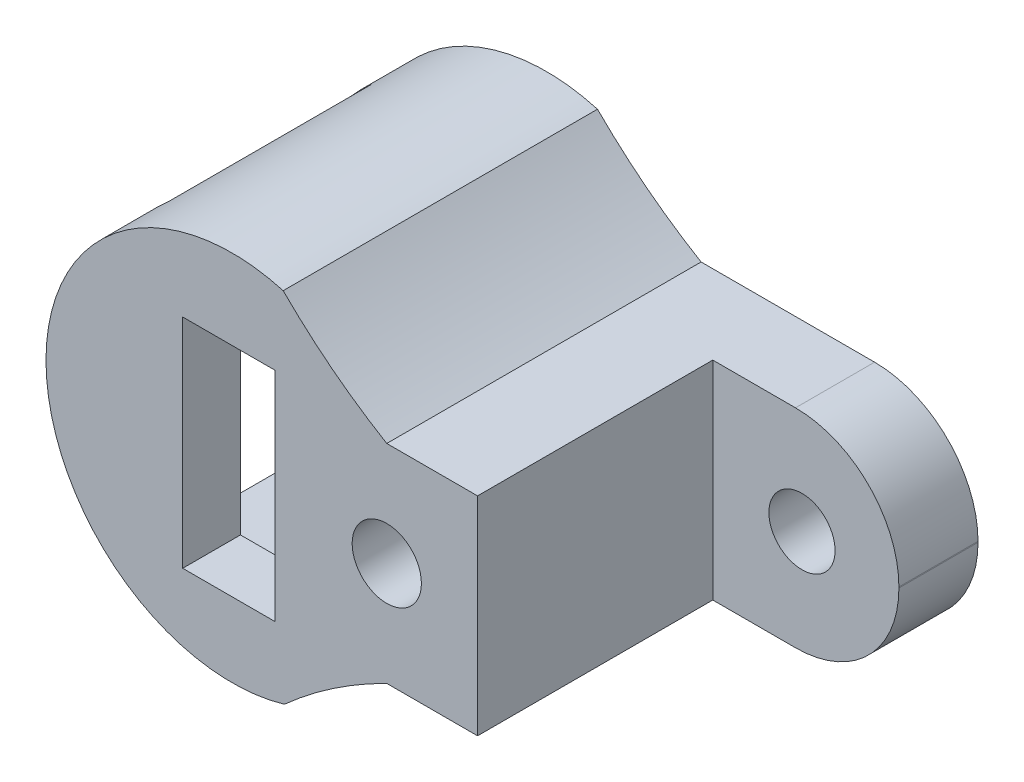
from build123d import *

# Parameters (mm, degrees)
EXTRUDE_1_DEPTH      = 2.2
EXTRUDE_2_DEPTH      = 3.25
SKETCH_3_W           = 50
SKETCH_3_H           = 10.05
EXTRUDE_3_DEPTH      = 3.25
CUT_EXTRUDE_1_DEPTH  = 30
EXTRUDE_4_REACH      = 56.389
SKETCH_6_R           = 5.025
SKETCH_8_R           = 1.675
SKETCH_8_R_2         = 0.84
CUT_EXTRUDE_3_DEPTH  = 55
SKETCH_9_W           = 28.473000816
SKETCH_9_H           = 14.532409192
CUT_EXTRUDE_4_DEPTH  = 3
EXTRUDE_5_DEPTH      = 2.45
SKETCH_11_W          = 12.614203935
SKETCH_11_H          = 10.05
EXTRUDE_6_DEPTH      = 3
SKETCH_12_W          = 36.628466797
SKETCH_12_H          = 15.348537224
CUT_EXTRUDE_5_DEPTH  = 10
SKETCH_13_W          = 5.35
SKETCH_13_H          = 5.35
CUT_EXTRUDE_6_DEPTH  = 14
SKETCH_14_R          = 1.1
CUT_EXTRUDE_7_DEPTH  = 14
SKETCH_15_R          = 1.1
CUT_EXTRUDE_8_DEPTH  = 10
SKETCH_16_R          = 1.625
EXTRUDE_7_DEPTH      = 5.7
SKETCH_17_W          = 19.923143876
SKETCH_17_H          = 15.083058075
CUT_EXTRUDE_9_DEPTH  = 3
SKETCH_18_R          = 1.675
SKETCH_18_R_2        = 1.6
CUT_EXTRUDE_10_DEPTH = 6
CUT_EXTRUDE_11_DEPTH = 10
EXTRUDE_8_DEPTH      = 9.5
EXTRUDE_9_DEPTH      = 15.2
SKETCH_23_W          = 14.793785908
SKETCH_23_H          = 11.59723546
CUT_EXTRUDE_12_DEPTH = 9
SKETCH_25_R          = 1.6
SKETCH_25_R_2        = 1.673969756
CUT_EXTRUDE_13_DEPTH = 20
FILLET_1_R           = 5
SKETCH_26_W          = 0.925753523
SKETCH_26_H          = 16.271734405
EXTRUDE_10_DEPTH     = 15
SKETCH_27_W          = 9.8
SKETCH_27_H          = 13.8
CUT_EXTRUDE_14_DEPTH = 12
SKETCH_28_W          = 4.460954542
SKETCH_28_H          = 10.524407061
CUT_EXTRUDE_15_DEPTH = 12
SKETCH_29_W          = 0.925753523
SKETCH_29_H          = 16.271734405
CUT_EXTRUDE_16_DEPTH = 18
SKETCH_30_W          = 1.5
SKETCH_30_H          = 13.8
EXTRUDE_11_DEPTH     = 3.25


with BuildPart() as part:
    # 草图1 → 凸台-拉伸1 (new body)
    with BuildSketch(Plane.XY):
        with BuildLine():
            Line((1.539836705, 12.851012384), (15.55297303, 14.251012384))
            ThreePointArc((15.55297303, 14.251012384), (17.193415997, 16.063512384), (15.55297303, 17.876012384))
            Line((15.55297303, 17.876012384), (1.500532553, 18.901012384))
            ThreePointArc((1.500532553, 18.901012384), (0.527100583, 19.384612538), (-0.54702697, 19.551012384))
            Line((-0.54702697, 19.551012384), (-0.54702697, 20.901012384))
            Line((-0.54702697, 20.901012384), (19.51277613, 20.901012384))
            Line((19.51277613, 20.901012384), (41.45297303, 20.901012384))
            Line((41.45297303, 20.901012384), (41.45297303, 10.851012384))
            Line((41.45297303, 10.851012384), (-0.54702697, 10.851012384))
            Line((-0.54702697, 10.851012384), (-0.54702697, 12.201012384))
            ThreePointArc((-0.54702697, 12.201012384), (0.54584768, 12.367273294), (1.539836705, 12.851012384))
        make_face()
    extrude(amount=EXTRUDE_1_DEPTH)

    # 草图2 → 凸台-拉伸2 (add)
    with BuildSketch(Plane(origin=(0, 0, 0), x_dir=(-1, 0, 0), z_dir=(0, 0, -1))):
        Polygon((-19.51277613, 10.851012384), (-49.45297303, 10.851012384), (-49.45297303, 20.901012384), (-19.51277613, 20.901012384), (0.54702697, 20.901012384), (0.54702697, 10.851012384), align=None)
    extrude(amount=EXTRUDE_2_DEPTH)

    # 草图3 → 凸台-拉伸3 (add)
    with BuildSketch(Plane.XY.offset(2.2)):
        with Locations((24.45297303, 15.876012384)):
            Rectangle(SKETCH_3_W, SKETCH_3_H)
    extrude(amount=EXTRUDE_3_DEPTH)

    # 草图4 → 切除-拉伸1 (cut, symmetric)
    with BuildSketch(Plane.XY):
        with BuildLine():
            Line((-0.54702697, 19.551012384), (-2.235397712, 16.616091152))
            Line((-2.235397712, 16.616091152), (-1.110896638, 12.310548833))
            Line((-1.110896638, 12.310548833), (-0.54702697, 12.201012384))
            ThreePointArc((-0.54702697, 12.201012384), (0.54584768, 12.367273294), (1.539836705, 12.851012384))
            ThreePointArc((1.539836705, 12.851012384), (2.773180655, 15.88415254), (1.500532553, 18.901012384))
            ThreePointArc((1.500532553, 18.901012384), (0.527100583, 19.384612538), (-0.54702697, 19.551012384))
        make_face()
    extrude(amount=CUT_EXTRUDE_1_DEPTH, both=True, mode=Mode.SUBTRACT)

    # 凸台-拉伸4: up to this face of the body (flat: up to its plane)
    extrude_4_end = Plane(part.part.faces().sort_by_distance((25.407741746, 15.876338503, 5.45))[0])
    # 草图6 → 凸台-拉伸4 (add, up to the picked face)
    with BuildSketch(Plane(origin=(0, 0, -3.25), x_dir=(-1, 0, 0), z_dir=(0, 0, -1)), mode=Mode.PRIVATE) as extrude_4_sk1:
        with Locations(Location((-49.45297303, 15.876012384, 0), (0, 0, 90))):
            Circle(SKETCH_6_R)
    extrude_4_tool1 = split(extrude(extrude_4_sk1.sketch, amount=-EXTRUDE_4_REACH, mode=Mode.PRIVATE), bisect_by=extrude_4_end, keep=Keep.BOTH, mode=Mode.PRIVATE)
    add(extrude_4_tool1.solids().sort_by(Axis((49.452973, 15.876012, -3.25), (0, 0, 1)))[0])

    # 草图8 → 切除-拉伸3 (cut)
    with BuildSketch(Plane(origin=(0, 0, -3.25), x_dir=(-1, 0, 0), z_dir=(0, 0, -1))):
        with Locations((-49.45297303, 15.876012384)):
            Circle(SKETCH_8_R)
        with Locations(Location((-7.95297303, 15.856360308, 0), (0, 0, 180))):
            Circle(SKETCH_8_R_2)
    extrude(amount=-CUT_EXTRUDE_3_DEPTH, mode=Mode.SUBTRACT)

    # 草图9 → 切除-拉伸4 (cut)
    with BuildSketch(Plane(origin=(0, 0, -3.25), x_dir=(-1, 0, 0), z_dir=(0, 0, -1))):
        with Locations((-42.648638606, 15.039406696)):
            Rectangle(SKETCH_9_W, SKETCH_9_H)
    extrude(amount=-CUT_EXTRUDE_4_DEPTH, mode=Mode.SUBTRACT)

    # 草图10 → 凸台-拉伸5 (add)
    with BuildSketch(Plane(origin=(0, 0, 2.2), x_dir=(-1, 0, 0), z_dir=(0, 0, -1))):
        with BuildLine():
            Line((-49.45297303, 20.901012384), (-38.466384114, 20.901012384))
            Line((-38.466384114, 20.901012384), (-38.466384114, 10.851012384))
            Line((-38.466384114, 10.851012384), (-49.45297303, 10.851012384))
            ThreePointArc((-49.45297303, 10.851012384), (-46.217908976, 15.876012384), (-49.45297303, 20.901012384))
        make_face()
    extrude(amount=EXTRUDE_5_DEPTH)

    # 草图11 → 凸台-拉伸6 (add)
    with BuildSketch(Plane(origin=(0, 0, -3.25), x_dir=(-1, 0, 0), z_dir=(0, 0, -1))):
        with Locations((-32.625453647, 15.876012384)):
            Rectangle(SKETCH_11_W, SKETCH_11_H)
    extrude(amount=-EXTRUDE_6_DEPTH)

    # 草图12 → 切除-拉伸5 (cut)
    with BuildSketch(Plane(origin=(0, 0, -3.25), x_dir=(-1, 0, 0), z_dir=(0, 0, -1))):
        with Locations((-5.618322216, 15.103365543)):
            Rectangle(SKETCH_12_W, SKETCH_12_H)
    extrude(amount=-CUT_EXTRUDE_5_DEPTH, mode=Mode.SUBTRACT)

    # 草图13 → 切除-拉伸6 (cut)
    with BuildSketch(Plane.ZY.offset(-23.932555614)):
        with Locations((1.1, 16.124405573)):
            Rectangle(SKETCH_13_W, SKETCH_13_H)
    extrude(amount=-CUT_EXTRUDE_6_DEPTH, mode=Mode.SUBTRACT)

    # 草图14 → 切除-拉伸7 (cut)
    with BuildSketch(Plane(origin=(0, 20.901012384, 0), x_dir=(1, 0, 0), z_dir=(0, 1, 0))):
        with Locations(Location((30.538219594, -1.1, 0), (0, 0, 270))):
            Circle(SKETCH_14_R)
    extrude(amount=-CUT_EXTRUDE_7_DEPTH, mode=Mode.SUBTRACT)

    # 草图15 → 切除-拉伸8 (cut)
    with BuildSketch(Plane.XY.offset(5.45)):
        with Locations((36.879929969, 15.882801083)):
            Circle(SKETCH_15_R)
    extrude(amount=-CUT_EXTRUDE_8_DEPTH, mode=Mode.SUBTRACT)

    # 草图16 → 凸台-拉伸7 (add)
    with BuildSketch(Plane(origin=(0, 0, -0.25), x_dir=(-1, 0, 0), z_dir=(0, 0, -1))):
        with BuildLine():
            Line((-49.45297303, 20.901012384), (23.54702697, 20.901012384))
            ThreePointArc((23.54702697, 20.901012384), (28.57202697, 15.876012384), (23.54702697, 10.851012384))
            Line((23.54702697, 10.851012384), (-49.45297303, 10.851012384))
            Line((-49.45297303, 10.851012384), (-49.45297303, 20.901012384))
        make_face()
        with Locations((23.54702697, 15.876012384)):
            Circle(SKETCH_16_R, mode=Mode.SUBTRACT)
    extrude(amount=-EXTRUDE_7_DEPTH)

    # 草图17 → 切除-拉伸9 (cut)
    with BuildSketch(Plane(origin=(0, 0, -3.25), x_dir=(-1, 0, 0), z_dir=(0, 0, -1))):
        with Locations((-33.178239607, 16.007261263)):
            Rectangle(SKETCH_17_W, SKETCH_17_H)
    extrude(amount=-CUT_EXTRUDE_9_DEPTH, mode=Mode.SUBTRACT)

    # 草图18 → 切除-拉伸10 (cut)
    with BuildSketch(Plane(origin=(0, 0, -0.25), x_dir=(-1, 0, 0), z_dir=(0, 0, -1))):
        with Locations(Location((-49.45297303, 15.876012384, 0), (0, 0, 180))):
            Circle(SKETCH_18_R)
        with Locations((14.84318256, 15.876012384)):
            Circle(SKETCH_18_R_2)
        with BuildLine():
            Line((-31.661597205, 17.303258867), (8.461046927, 17.303258867))
            ThreePointArc((8.461046927, 17.303258867), (9.88829341, 15.876012384), (8.461046927, 14.448765901))
            Line((8.461046927, 14.448765901), (-31.661597205, 14.448765901))
            ThreePointArc((-31.661597205, 14.448765901), (-33.088843687, 15.876012384), (-31.661597205, 17.303258867))
        make_face()
    extrude(amount=-CUT_EXTRUDE_10_DEPTH, mode=Mode.SUBTRACT)

    # 草图19 → 切除-拉伸11 (cut)
    with BuildSketch(Plane(origin=(0, 0, -0.25), x_dir=(-1, 0, 0), z_dir=(0, 0, -1))):
        Polygon((12.697516125, 20.901012384), (-60.999534113, 39.375054119), (-58.738783937, -10.22846445), (12.697516125, 10.851012384), (10.156545193, 10.851012384), (10.156545193, 20.901012384), align=None)
    extrude(amount=-CUT_EXTRUDE_11_DEPTH, mode=Mode.SUBTRACT)

    # 草图21 → 凸台-拉伸8 (add)
    with BuildSketch(Plane.XY.offset(5.45)):
        with BuildLine():
            Line((-23.54702697, 20.901012384), (-12.697516125, 20.901012384))
            ThreePointArc((-12.697516125, 20.901012384), (-9.87974938, 15.876012384), (-12.697516125, 10.851012384))
            Line((-12.697516125, 10.851012384), (-23.54702697, 10.851012384))
            ThreePointArc((-23.54702697, 10.851012384), (-28.57202697, 15.876012384), (-23.54702697, 20.901012384))
        make_face()
    extrude(amount=EXTRUDE_8_DEPTH)

    # 草图22 → 凸台-拉伸9 (add)
    with BuildSketch(Plane(origin=(0, 0, -0.25), x_dir=(-1, 0, 0), z_dir=(0, 0, -1))):
        with BuildLine():
            Line((23.54702697, 20.901012384), (26.601137036, 16.368267617))
            Line((26.601137036, 16.368267617), (23.54702697, 10.851012384))
            ThreePointArc((23.54702697, 10.851012384), (26.137365286, 9.34674893), (28.497704507, 7.502444211))
            ThreePointArc((28.497704507, 7.502444211), (40.025732832, 16.109516943), (28.556434004, 24.794695265))
            ThreePointArc((28.556434004, 24.794695265), (26.173914365, 22.690658492), (23.54702697, 20.901012384))
        make_face()
    extrude(amount=-EXTRUDE_9_DEPTH)

    # 草图23 → 切除-拉伸12 (cut, symmetric)
    with BuildSketch(Plane(origin=(-10.156545193, 0, 0), x_dir=(0, 0, -1), z_dir=(1, 0, 0))):
        with Locations((-10.971714959, 15.6975909)):
            Rectangle(SKETCH_23_W, SKETCH_23_H)
    extrude(amount=CUT_EXTRUDE_12_DEPTH, both=True, mode=Mode.SUBTRACT)

    # 草图25 → 切除-拉伸13 (cut)
    with BuildSketch(Plane(origin=(0, 0, -0.25), x_dir=(-1, 0, 0), z_dir=(0, 0, -1))):
        with Locations((14.84318256, 15.876012384)):
            Circle(SKETCH_25_R)
        with Locations((23.54702697, 15.876012384)):
            Circle(SKETCH_25_R_2)
    extrude(amount=-CUT_EXTRUDE_13_DEPTH, mode=Mode.SUBTRACT)

    # 圆角1
    fillet_1_edges = [part.edges().sort_by_distance(p)[0] for p in [
        (-10.156545193, 10.851012384, 1.662411002),
        (-10.156545193, 20.901012384, 1.662411002),
    ]]
    fillet(fillet_1_edges, radius=FILLET_1_R)

    # 草图26 → 凸台-拉伸10 (add)
    with BuildSketch(Plane(origin=(0, 0, -0.25), x_dir=(-1, 0, 0), z_dir=(0, 0, -1))):
        with Locations((40.488609594, 16.108824789)):
            Rectangle(SKETCH_26_W, SKETCH_26_H)
    extrude(amount=-EXTRUDE_10_DEPTH)

    # 草图27 → 切除-拉伸14 (cut)
    with BuildSketch(Plane.ZY.offset(40.951486355)):
        with Locations((7.257156835, 16.078298666)):
            Rectangle(SKETCH_27_W, SKETCH_27_H)
    extrude(amount=-CUT_EXTRUDE_14_DEPTH, mode=Mode.SUBTRACT)

    # 草图28 → 切除-拉伸15 (cut)
    with BuildSketch(Plane(origin=(0, 0, 12.157156835), x_dir=(-1, 0, 0), z_dir=(0, 0, -1))):
        with Locations((31.184244341, 16.001788247)):
            Rectangle(SKETCH_28_W, SKETCH_28_H)
    extrude(amount=-CUT_EXTRUDE_15_DEPTH, mode=Mode.SUBTRACT)

    # 草图29 → 切除-拉伸16 (cut)
    with BuildSketch(Plane(origin=(0, 0, -0.25), x_dir=(-1, 0, 0), z_dir=(0, 0, -1))):
        with Locations((40.488609594, 16.108824789)):
            Rectangle(SKETCH_29_W, SKETCH_29_H)
    extrude(amount=-CUT_EXTRUDE_16_DEPTH, mode=Mode.SUBTRACT)

    # 草图30 → 凸台-拉伸11 (add)
    with BuildSketch(Plane.ZY.offset(28.951486355)):
        with Locations((3.107156835, 16.078298666)):
            Rectangle(SKETCH_30_W, SKETCH_30_H)
    extrude(amount=EXTRUDE_11_DEPTH)


solid = part.part
